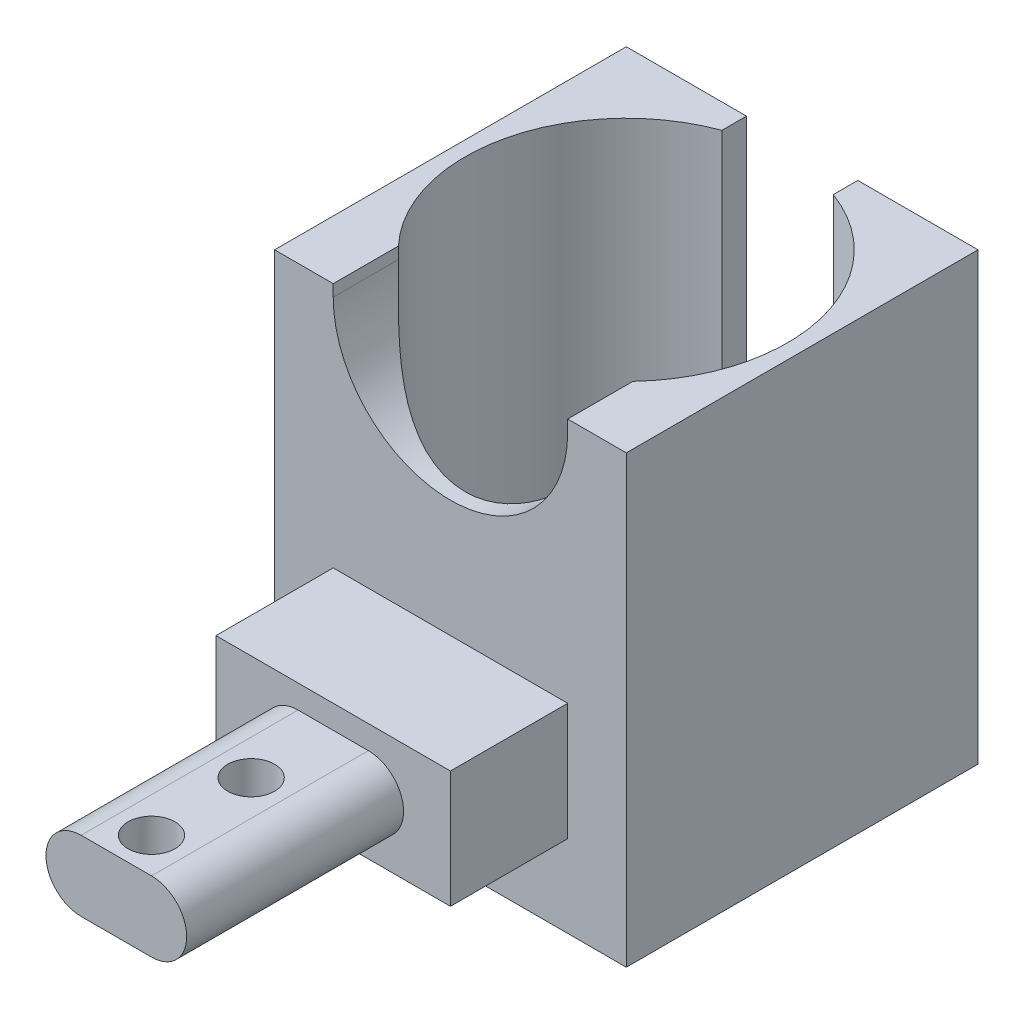
from build123d import *

# Parameters (mm, degrees)
SKETCH1_W               = 30
SKETCH1_H               = 36
BOSS_EXTRUDE1_DEPTH     = 30
SKETCH2_W               = 20
SKETCH2_H               = 10
BOSS_EXTRUDE2_DEPTH     = 10
BOSS_EXTRUDE3_DEPTH     = 18.5
CUT_EXTRUDE2_REACH      = 72.308
SKETCH4_R               = 13.75
CUT_EXTRUDE5_REACH      = 65.018
CUT_EXTRUDE5_END_RADIUS = 13.75
CUT_EXTRUDE6_REACH      = 40.066
CUT_EXTRUDE6_END_RADIUS = 13.75
CUT_EXTRUDE7_REACH      = 72.308
SKETCH9_R               = 2
SKETCH10_W              = 30
SKETCH10_H              = 30
BOSS_EXTRUDE4_DEPTH     = 2
CUT_EXTRUDE8_REACH      = 72.308
SKETCH11_R              = 13.25


with BuildPart() as part:
    # Sketch1 → Boss-Extrude1 (new body)
    with BuildSketch(Plane.XY):
        Rectangle(SKETCH1_W, SKETCH1_H)
    extrude(amount=BOSS_EXTRUDE1_DEPTH)

    # Sketch2 → Boss-Extrude2 (add)
    with BuildSketch(Plane.XY.offset(30)):
        with Locations((0, -8)):
            Rectangle(SKETCH2_W, SKETCH2_H)
    extrude(amount=BOSS_EXTRUDE2_DEPTH)

    # Sketch3 → Boss-Extrude3 (add)
    with BuildSketch(Plane.XY.offset(40)):
        with BuildLine():
            Line((-3, -5), (3, -5))
            ThreePointArc((3, -5), (6, -8), (3, -11))
            Line((3, -11), (-3, -11))
            ThreePointArc((-3, -11), (-6, -8), (-3, -5))
        make_face()
    extrude(amount=BOSS_EXTRUDE3_DEPTH)

    # Sketch4 → Cut-Extrude2 (cut, up to next)
    with BuildSketch(Plane(origin=(0, 18, 0), x_dir=(1, 0, 0), z_dir=(0, 1, 0)), mode=Mode.PRIVATE) as cut_extrude2_sk1:
        with Locations(Location((0, -15, 0), (0, 0, 270))):
            Circle(SKETCH4_R)
    cut_extrude2_tool1 = extrude(cut_extrude2_sk1.sketch, amount=-CUT_EXTRUDE2_REACH, mode=Mode.PRIVATE) & part.part
    add(cut_extrude2_tool1.solids().sort_by_distance((0, 18, 15))[0], mode=Mode.SUBTRACT)

    # Cut-Extrude5: up to this cylinder (the profile starts outside it)
    cut_extrude5_end = Plane(origin=(0, 7.875, 15), z_dir=(0, 1, 0)) * Cylinder(CUT_EXTRUDE5_END_RADIUS, 158.536, mode=Mode.PRIVATE)
    # Sketch6 → Cut-Extrude5 (cut, up to the surface)
    with BuildSketch(Plane(origin=(0, 0, 0), x_dir=(-1, 0, 0), z_dir=(0, 0, -1)), mode=Mode.PRIVATE) as cut_extrude5_sk1:
        with BuildLine():
            Line((-4.75, -2.25), (-4.75, 18))
            ThreePointArc((-4.75, 18), (0, 22.75), (4.75, 18))
            Line((4.75, 18), (4.75, -2.25))
            ThreePointArc((4.75, -2.25), (0, -7), (-4.75, -2.25))
        make_face()
    cut_extrude5_tool1 = extrude(cut_extrude5_sk1.sketch, amount=-CUT_EXTRUDE5_REACH, mode=Mode.PRIVATE) - cut_extrude5_end
    add(cut_extrude5_tool1.solids().sort_by_distance((0, 7.875, 0))[0], mode=Mode.SUBTRACT)

    # Cut-Extrude6: up to this cylinder (the profile starts outside it)
    cut_extrude6_end = Plane(origin=(0, 17.5, 15), z_dir=(0, 1, 0)) * Cylinder(CUT_EXTRUDE6_END_RADIUS, 108.632, mode=Mode.PRIVATE)
    # Sketch8 → Cut-Extrude6 (cut, up to the surface)
    with BuildSketch(Plane.XY.offset(30), mode=Mode.PRIVATE) as cut_extrude6_sk1:
        with BuildLine():
            Line((-10, 17), (-10, 18))
            ThreePointArc((-10, 18), (0, 28), (10, 18))
            Line((10, 18), (10, 17))
            ThreePointArc((10, 17), (0, 7), (-10, 17))
        make_face()
    cut_extrude6_tool1 = extrude(cut_extrude6_sk1.sketch, amount=-CUT_EXTRUDE6_REACH, mode=Mode.PRIVATE) - cut_extrude6_end
    add(cut_extrude6_tool1.solids().sort_by_distance((0, 17.5, 30))[0], mode=Mode.SUBTRACT)

    # Sketch9 → Cut-Extrude7 (cut, up to next)
    with BuildSketch(Plane.XZ.offset(18), mode=Mode.PRIVATE) as cut_extrude7_sk1:
        with Locations(Location((0, 55.5, 0), (0, 0, 270))):
            Circle(SKETCH9_R)
    cut_extrude7_tool1 = extrude(cut_extrude7_sk1.sketch, amount=-CUT_EXTRUDE7_REACH, mode=Mode.PRIVATE) & part.part
    # Sketch9 → Cut-Extrude7 (cut, up to next)
    with BuildSketch(Plane.XZ.offset(18), mode=Mode.PRIVATE) as cut_extrude7_sk2:
        with Locations(Location((0, 47, 0), (0, 0, 270))):
            Circle(SKETCH9_R)
    cut_extrude7_tool2 = extrude(cut_extrude7_sk2.sketch, amount=-CUT_EXTRUDE7_REACH, mode=Mode.PRIVATE) & part.part
    add(cut_extrude7_tool1.solids().sort_by_distance((0, -18, 55.5))[0], mode=Mode.SUBTRACT)
    add(cut_extrude7_tool2.solids().sort_by_distance((0, -18, 47))[0], mode=Mode.SUBTRACT)

    # Sketch10 → Boss-Extrude4 (add)
    with BuildSketch(Plane(origin=(0, -18, 0), x_dir=(-1, 0, 0), z_dir=(0, -1, 0))):
        with Locations((0, -15)):
            Rectangle(SKETCH10_W, SKETCH10_H)
    extrude(amount=BOSS_EXTRUDE4_DEPTH)

    # Sketch11 → Cut-Extrude8 (cut, up to next)
    with BuildSketch(Plane(origin=(0, -18, 0), x_dir=(1, 0, 0), z_dir=(0, 1, 0)), mode=Mode.PRIVATE) as cut_extrude8_sk1:
        with Locations(Location((0, -15, 0), (0, 0, 270))):
            Circle(SKETCH11_R)
    cut_extrude8_tool1 = extrude(cut_extrude8_sk1.sketch, amount=-CUT_EXTRUDE8_REACH, mode=Mode.PRIVATE) & part.part
    add(cut_extrude8_tool1.solids().sort_by_distance((0, -18, 15))[0], mode=Mode.SUBTRACT)


solid = part.part
